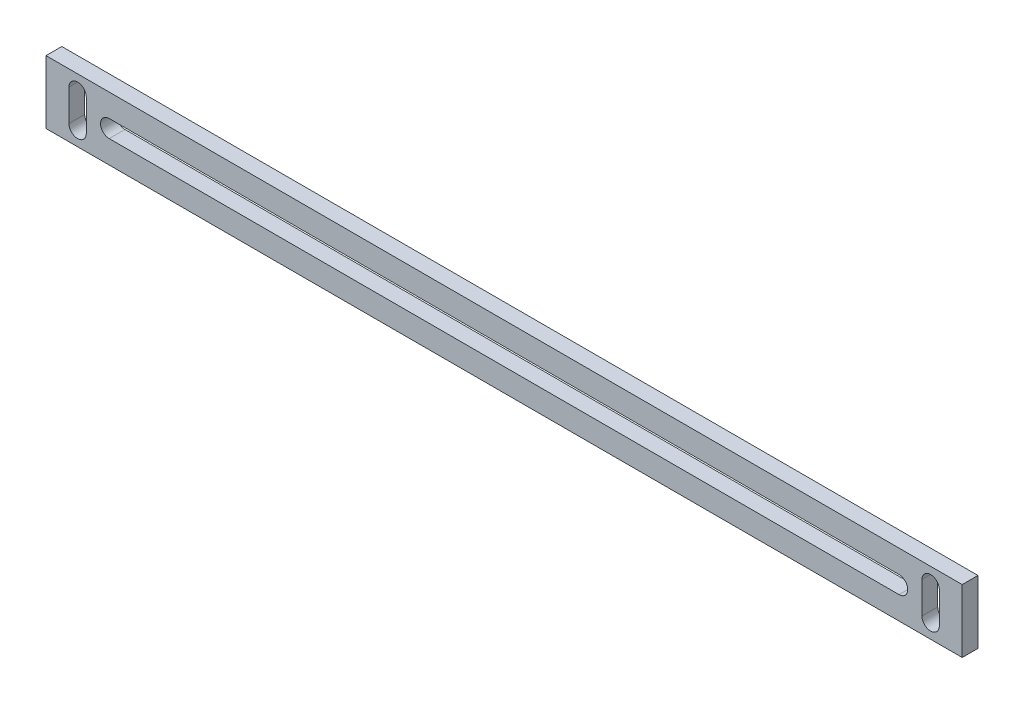
from build123d import *

# Parameters (mm, degrees)
EXTRUDE_1_DEPTH     = 5
CUT_EXTRUDE_1_DEPTH = 5


with BuildPart() as part:
    # 草图1 → 凸台-拉伸1 (new body)
    with BuildSketch(Plane.XY):
        Polygon((145, 10), (0, 10), (-145, 10), (-145, -10), (145, -10), align=None)
    extrude(amount=EXTRUDE_1_DEPTH)

    # 草图3 → 切除-拉伸1 (cut)
    with BuildSketch(Plane(origin=(0, 0, 0), x_dir=(-1, 0, 0), z_dir=(0, 0, -1))):
        with BuildLine():
            Line((-135, 5), (-135, 0))
            Line((-135, 0), (-132.25, 0))
            Line((-132.25, 0), (-132.25, 5))
            ThreePointArc((-132.25, 5), (-133.055456352, 6.944543648), (-135, 7.75))
            Line((-135, 7.75), (-135, 5))
        make_face()
        with BuildLine():
            Line((-137.75, 5), (-137.75, 0))
            Line((-137.75, 0), (-135, 0))
            Line((-135, 0), (-135, 5))
            Line((-135, 5), (-135, 7.75))
            ThreePointArc((-135, 7.75), (-136.944543648, 6.944543648), (-137.75, 5))
        make_face()
        with BuildLine():
            Line((-135, 0), (-137.75, 0))
            Line((-137.75, 0), (-137.75, -5))
            ThreePointArc((-137.75, -5), (-136.944543648, -6.944543648), (-135, -7.75))
            Line((-135, -7.75), (-135, -5))
            Line((-135, -5), (-135, 0))
        make_face()
        with BuildLine():
            Line((-132.25, 0), (-135, 0))
            Line((-135, 0), (-135, -5))
            Line((-135, -5), (-135, -7.75))
            ThreePointArc((-135, -7.75), (-133.055456352, -6.944543648), (-132.25, -5))
            Line((-132.25, -5), (-132.25, 0))
        make_face()
        with BuildLine():
            Line((-125, 0), (-127.75, 0))
            ThreePointArc((-127.75, 0), (-126.944543648, -1.944543648), (-125, -2.75))
            Line((-125, -2.75), (125, -2.75))
            ThreePointArc((125, -2.75), (126.944543648, -1.944543648), (127.75, 0))
            Line((127.75, 0), (125, 0))
            Line((125, 0), (-125, 0))
        make_face()
        with BuildLine():
            ThreePointArc((-125, 2.75), (-126.944543648, 1.944543648), (-127.75, 0))
            Line((-127.75, 0), (-125, 0))
            Line((-125, 0), (125, 0))
            Line((125, 0), (127.75, 0))
            ThreePointArc((127.75, 0), (126.944543648, 1.944543648), (125, 2.75))
            Line((125, 2.75), (-125, 2.75))
        make_face()
        with BuildLine():
            Line((135, 5), (135, 0))
            Line((135, 0), (137.75, 0))
            Line((137.75, 0), (137.75, 5))
            ThreePointArc((137.75, 5), (136.944543648, 6.944543648), (135, 7.75))
            Line((135, 7.75), (135, 5))
        make_face()
        with BuildLine():
            Line((132.25, 5), (132.25, 0))
            Line((132.25, 0), (135, 0))
            Line((135, 0), (135, 5))
            Line((135, 5), (135, 7.75))
            ThreePointArc((135, 7.75), (133.055456352, 6.944543648), (132.25, 5))
        make_face()
        with BuildLine():
            Line((135, 0), (132.25, 0))
            Line((132.25, 0), (132.25, -5))
            ThreePointArc((132.25, -5), (133.055456352, -6.944543648), (135, -7.75))
            Line((135, -7.75), (135, -5))
            Line((135, -5), (135, 0))
        make_face()
        with BuildLine():
            Line((137.75, 0), (135, 0))
            Line((135, 0), (135, -5))
            Line((135, -5), (135, -7.75))
            ThreePointArc((135, -7.75), (136.944543648, -6.944543648), (137.75, -5))
            Line((137.75, -5), (137.75, 0))
        make_face()
    extrude(amount=-CUT_EXTRUDE_1_DEPTH, mode=Mode.SUBTRACT)


solid = part.part
